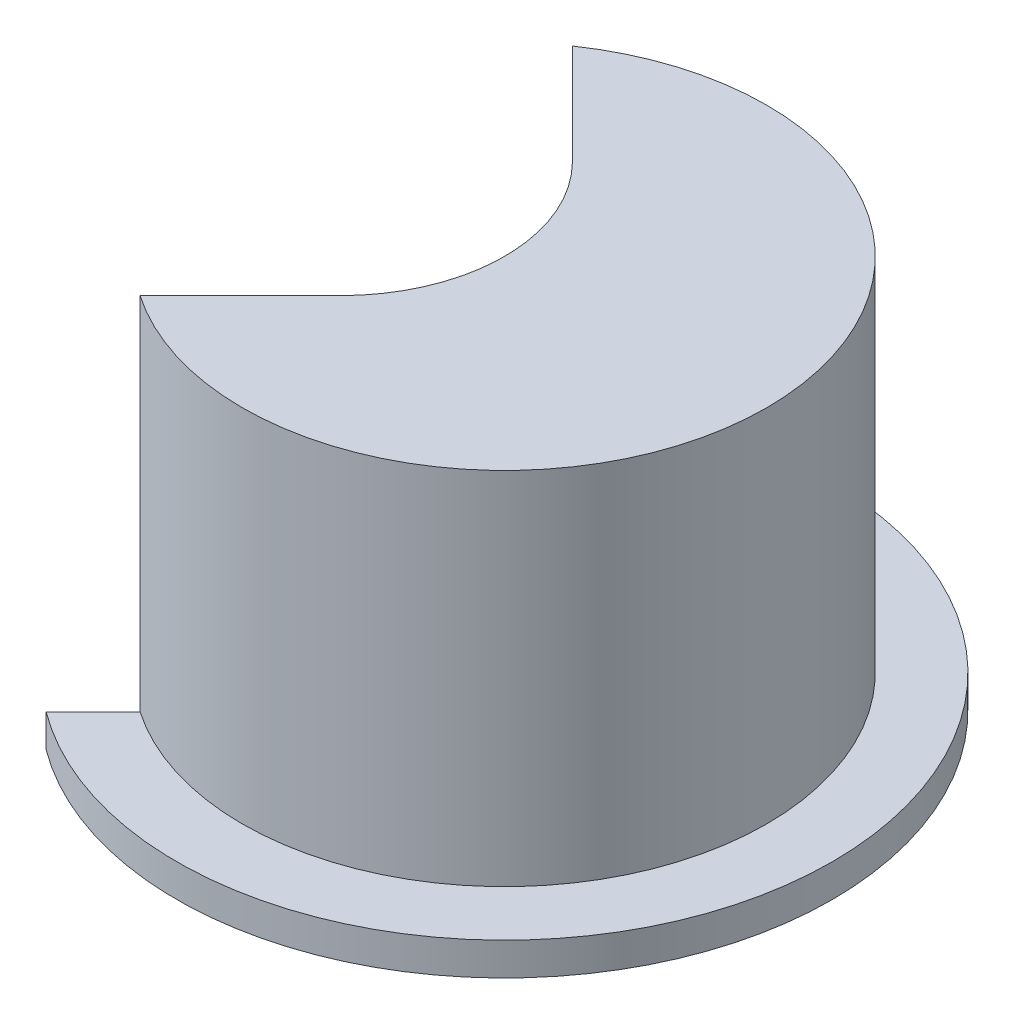
from build123d import *

# Parameters (mm, degrees)
SKETCH1_R           = 5
SKETCH1_R_2         = 4
BOSS_EXTRUDE1_DEPTH = 0.5
SKETCH1_3_R         = 4
BOSS_EXTRUDE2_DEPTH = 6
CUT_EXTRUDE2_DEPTH  = 10.273618495


with BuildPart() as part:
    # Sketch1 → Boss-Extrude1 (new body)
    with BuildSketch(Plane(origin=(0, 0, 0), x_dir=(1, 0, 0), z_dir=(0, 1, 0))):
        Circle(SKETCH1_R)
        Circle(SKETCH1_R_2, mode=Mode.SUBTRACT)
    extrude(amount=BOSS_EXTRUDE1_DEPTH)

    # Sketch1<3> → Boss-Extrude2 (add)
    with BuildSketch(Plane(origin=(0, 0, 0), x_dir=(1, 0, 0), z_dir=(0, 1, 0))):
        Circle(SKETCH1_3_R)
    extrude(amount=BOSS_EXTRUDE2_DEPTH)

    # Sketch2 → Cut-Extrude2 (cut, through all)
    with BuildSketch(Plane(origin=(0, 0, 0), x_dir=(1, 0, 0), z_dir=(0, 1, 0))):
        with BuildLine():
            Line((-0.732233047, 1.767766953), (-2.979648862, 4.015182768))
            ThreePointArc((-2.979648862, 4.015182768), (-5, 0), (-2.979648862, -4.015182768))
            Line((-2.979648862, -4.015182768), (-0.732233047, -1.767766953))
            ThreePointArc((-0.732233047, -1.767766953), (0, 0), (-0.732233047, 1.767766953))
        make_face()
    extrude(amount=CUT_EXTRUDE2_DEPTH, mode=Mode.SUBTRACT)


solid = part.part
